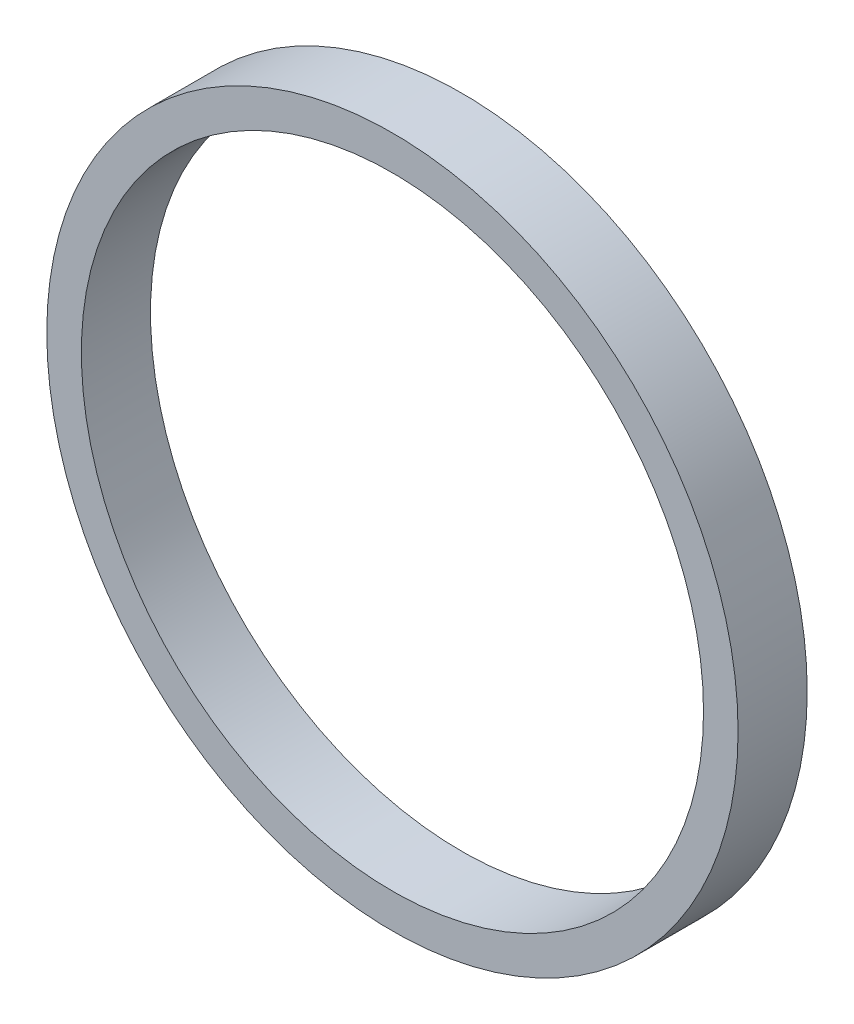
from build123d import *

# Parameters (mm, degrees)
SKETCH1_R           = 50
SKETCH1_R_2         = 45
BOSS_EXTRUDE1_DEPTH = 10


with BuildPart() as part:
    # Sketch1 → Boss-Extrude1 (new body)
    with BuildSketch(Plane.XY):
        Circle(SKETCH1_R)
        Circle(SKETCH1_R_2, mode=Mode.SUBTRACT)
    extrude(amount=BOSS_EXTRUDE1_DEPTH)


solid = part.part
